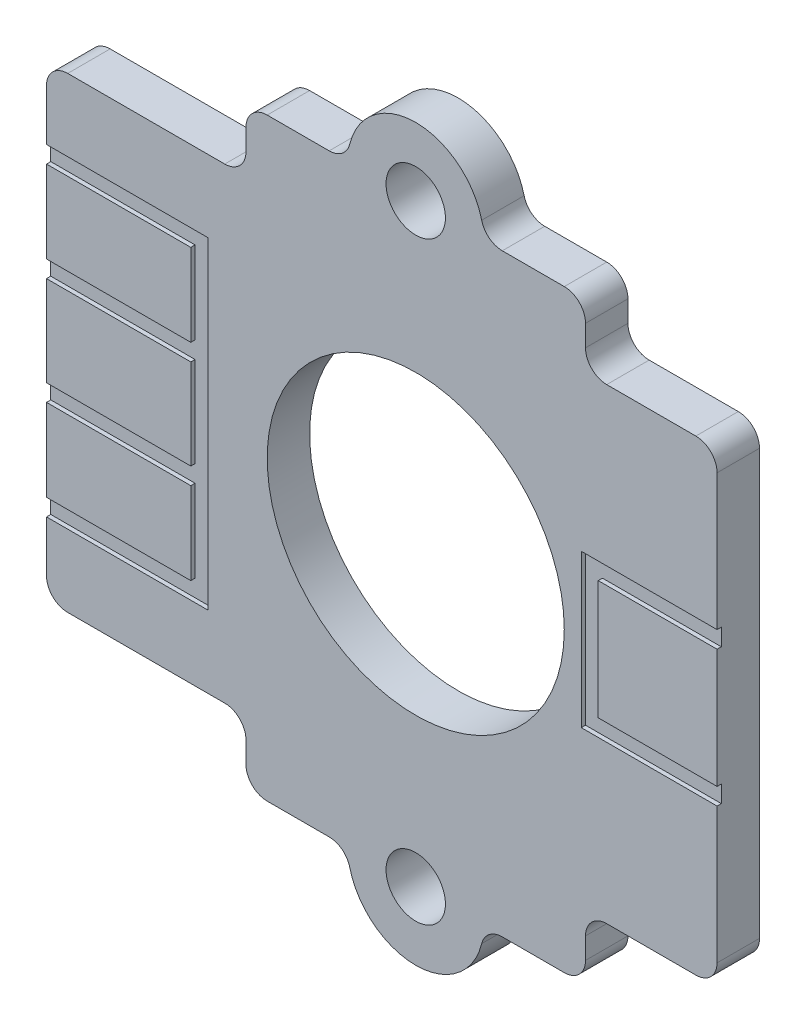
from build123d import *

# Parameters (mm, degrees)
MODEL_R         = 3.5
MODEL_R_2       = 0.7
EXTRUDE_1_DEPTH = 0.5
EXTRUDE2_DEPTH  = 0.1


with BuildPart() as part:
    # Model → Бобышка-Вытянуть1 (new, symmetric)
    with BuildSketch(Plane.XY):
        with BuildLine():
            Line((-3.5, 7), (-2.039607805, 7))
            ThreePointArc((-2.039607805, 7), (-1.731001106, 7.106602104), (-1.553986899, 7.380952381))
            ThreePointArc((-1.553986899, 7.380952381), (0, 8.6), (1.553986899, 7.380952381))
            ThreePointArc((1.553986899, 7.380952381), (1.731001106, 7.106602104), (2.039607805, 7))
            Line((2.039607805, 7), (3.5, 7))
            ThreePointArc((3.5, 7), (3.853553391, 6.853553391), (4, 6.5))
            Line((4, 6.5), (4, 6))
            ThreePointArc((4, 6), (4.146446609, 5.646446609), (4.5, 5.5))
            Line((4.5, 5.5), (6.6, 5.5))
            ThreePointArc((6.6, 5.5), (6.953553391, 5.353553391), (7.1, 5))
            Line((7.1, 5), (7.1, -5))
            ThreePointArc((7.1, -5), (6.953553391, -5.353553391), (6.6, -5.5))
            Line((6.6, -5.5), (4.5, -5.5))
            ThreePointArc((4.5, -5.5), (4.146446609, -5.646446609), (4, -6))
            Line((4, -6), (4, -6.5))
            ThreePointArc((4, -6.5), (3.853553391, -6.853553391), (3.5, -7))
            Line((3.5, -7), (2.039607805, -7))
            ThreePointArc((2.039607805, -7), (1.731001106, -7.106602104), (1.553986899, -7.380952381))
            ThreePointArc((1.553986899, -7.380952381), (0, -8.6), (-1.553986899, -7.380952381))
            ThreePointArc((-1.553986899, -7.380952381), (-1.731001106, -7.106602104), (-2.039607805, -7))
            Line((-2.039607805, -7), (-3.5, -7))
            ThreePointArc((-3.5, -7), (-3.853553391, -6.853553391), (-4, -6.5))
            Line((-4, -6.5), (-4, -6))
            ThreePointArc((-4, -6), (-4.146446609, -5.646446609), (-4.5, -5.5))
            Line((-4.5, -5.5), (-8.2, -5.5))
            ThreePointArc((-8.2, -5.5), (-8.553553391, -5.353553391), (-8.7, -5))
            Line((-8.7, -5), (-8.7, 5))
            ThreePointArc((-8.7, 5), (-8.553553391, 5.353553391), (-8.2, 5.5))
            Line((-8.2, 5.5), (-4.5, 5.5))
            ThreePointArc((-4.5, 5.5), (-4.146446609, 5.646446609), (-4, 6))
            Line((-4, 6), (-4, 6.5))
            ThreePointArc((-4, 6.5), (-3.853553391, 6.853553391), (-3.5, 7))
        make_face()
        Circle(MODEL_R, mode=Mode.SUBTRACT)
        with Locations((0, 7)):
            Circle(MODEL_R_2, mode=Mode.SUBTRACT)
        with Locations((0, -7)):
            Circle(MODEL_R_2, mode=Mode.SUBTRACT)
    extrude(amount=EXTRUDE_1_DEPTH, both=True)

    # Sketch2 → Extrude2 (cut)
    with BuildSketch(Plane.XY.offset(0.5)):
        Polygon((-9.557418436, -3.8), (-4.9, -3.8), (-4.9, 3.8), (-9.557418436, 3.8), (-9.557418436, 3.4), (-5.3, 3.4), (-5.3, 1.462476295), (-9.557418436, 1.462476295), (-9.557418436, 1.062476295), (-5.3, 1.062476295), (-5.3, -1.062476295), (-9.557418436, -1.062476295), (-9.557418436, -1.462476295), (-5.3, -1.462476295), (-5.3, -3.4), (-9.557418436, -3.4), align=None)
        Polygon((7.739654587, -1.8), (7.739654587, -1.4), (4.3, -1.4), (4.3, 1.4), (7.739654587, 1.4), (7.739654587, 1.8), (3.9, 1.8), (3.9, -1.8), align=None)
    extrude(amount=-EXTRUDE2_DEPTH, mode=Mode.SUBTRACT)


solid = part.part
